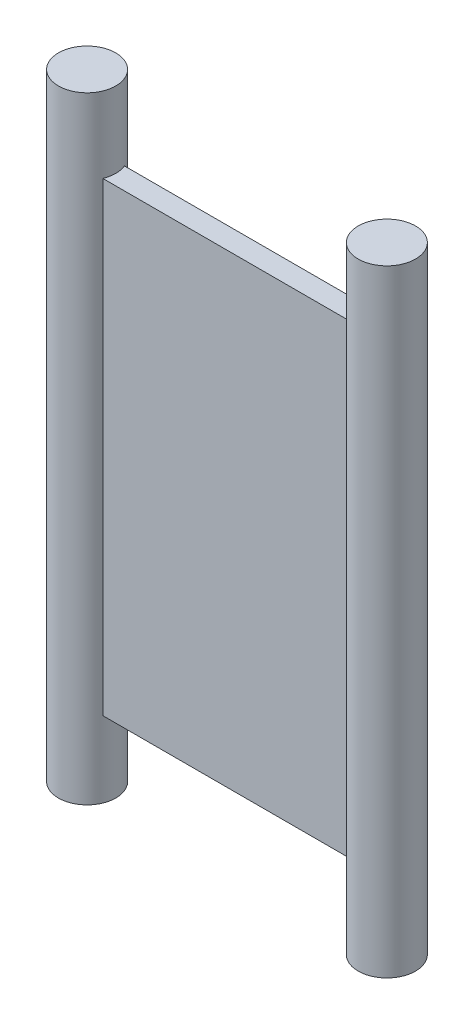
from build123d import *

# Parameters (mm, degrees)
SKETCH1_W           = 13.853
SKETCH1_H           = 1
BOSS_EXTRUDE1_DEPTH = 21.5
SKETCH2_R           = 1.325
BOSS_EXTRUDE2_DEPTH = 14.25


with BuildPart() as part:
    # Sketch1 → Boss-Extrude1 (new body)
    with BuildSketch(Plane(origin=(0, 0, 0), x_dir=(1, 0, 0), z_dir=(0, 1, 0))):
        Rectangle(SKETCH1_W, SKETCH1_H)
    extrude(amount=BOSS_EXTRUDE1_DEPTH)

    # Sketch2 → Boss-Extrude2 (add, symmetric)
    with BuildSketch(Plane(origin=(0, 10.75, 0), x_dir=(1, 0, 0), z_dir=(0, 1, 0))):
        with Locations(Location((-6.9265, 0, 0), (0, 0, 270))):
            Circle(SKETCH2_R)
        with Locations(Location((6.9265, 0, 0), (0, 0, 270))):
            Circle(SKETCH2_R)
    extrude(amount=BOSS_EXTRUDE2_DEPTH, both=True)


solid = part.part
